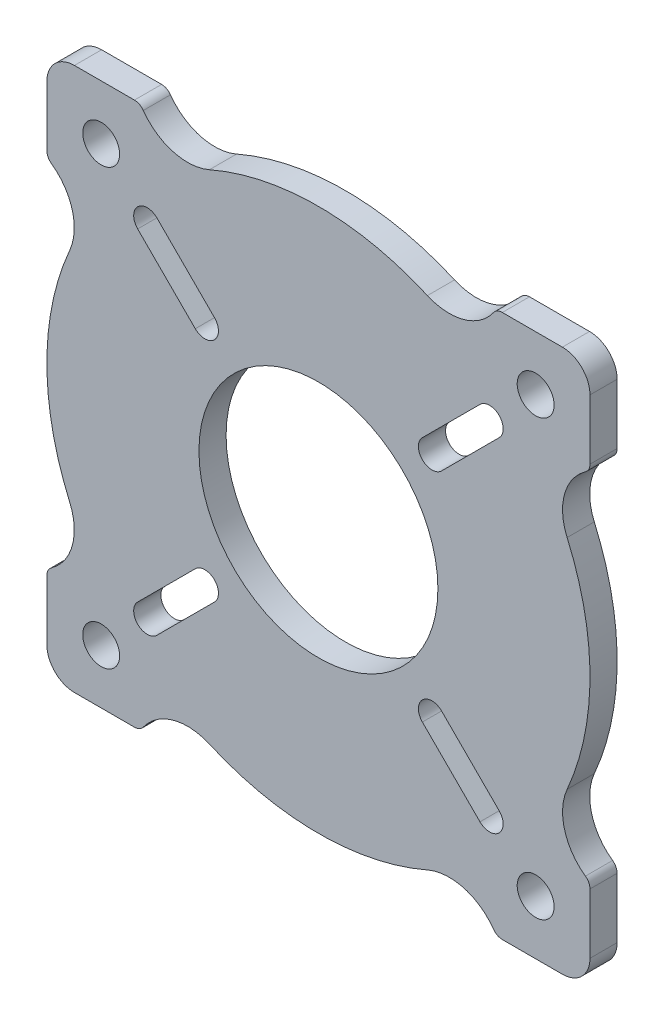
from build123d import *

# Parameters (mm, degrees)
ESQUISSE1_R        = 3.4
ESQUISSE1_R_2      = 22
BOSS_EXTRU_2_DEPTH = 5


with BuildPart() as part:
    # Esquisse1 → Boss.-Extru.2 (new body)
    with BuildSketch(Plane.XY):
        with BuildLine():
            ThreePointArc((44.919487431, -50), (48.51195232, -48.51195232), (50, -44.919487431))
            Line((50, -44.919487431), (50, -33.862050579))
            ThreePointArc((50, -33.862050579), (49.777389032, -32.945051), (49.159111773, -32.232185585))
            ThreePointArc((49.159111773, -32.232185585), (45.31641316, -26.748192273), (45.795558863, -20.069050512))
            ThreePointArc((45.795558863, -20.069050512), (48.937602838, -10.252366967), (50, 0))
            ThreePointArc((50, 0), (48.936869799, 10.255865358), (45.79268903, 20.075597908))
            ThreePointArc((45.79268903, 20.075597908), (45.313248124, 26.757056992), (49.158537806, 32.242082639))
            ThreePointArc((49.158537806, 32.242082639), (49.777227562, 32.955043184), (50, 33.872355669))
            Line((50, 33.872355669), (50, 44.919487431))
            ThreePointArc((50, 44.919487431), (48.51195232, 48.51195232), (44.919487431, 50))
            Line((44.919487431, 50), (33.862050579, 50))
            ThreePointArc((33.862050579, 50), (32.945051, 49.777389032), (32.232185585, 49.159111773))
            ThreePointArc((32.232185585, 49.159111773), (26.748192273, 45.31641316), (20.069050512, 45.795558863))
            ThreePointArc((20.069050512, 45.795558863), (10.252366967, 48.937602838), (0, 50))
            ThreePointArc((0, 50), (-10.255865358, 48.936869799), (-20.075597908, 45.79268903))
            ThreePointArc((-20.075597908, 45.79268903), (-26.757056992, 45.313248124), (-32.242082639, 49.158537806))
            ThreePointArc((-32.242082639, 49.158537806), (-32.955043184, 49.777227562), (-33.872355669, 50))
            Line((-33.872355669, 50), (-44.919487431, 50))
            ThreePointArc((-44.919487431, 50), (-48.51195232, 48.51195232), (-50, 44.919487431))
            Line((-50, 44.919487431), (-50, 33.862050579))
            ThreePointArc((-50, 33.862050579), (-49.777389032, 32.945051), (-49.159111773, 32.232185585))
            ThreePointArc((-49.159111773, 32.232185585), (-45.31641316, 26.748192273), (-45.795558863, 20.069050512))
            ThreePointArc((-45.795558863, 20.069050512), (-48.937602838, 10.252366967), (-50, 0))
            ThreePointArc((-50, 0), (-48.936869799, -10.255865358), (-45.79268903, -20.075597908))
            ThreePointArc((-45.79268903, -20.075597908), (-45.313248124, -26.757056992), (-49.158537806, -32.242082639))
            ThreePointArc((-49.158537806, -32.242082639), (-49.777227562, -32.955043184), (-50, -33.872355669))
            Line((-50, -33.872355669), (-50, -44.919487431))
            ThreePointArc((-50, -44.919487431), (-48.51195232, -48.51195232), (-44.919487431, -50))
            Line((-44.919487431, -50), (-33.862050579, -50))
            ThreePointArc((-33.862050579, -50), (-32.945051, -49.777389032), (-32.232185585, -49.159111773))
            ThreePointArc((-32.232185585, -49.159111773), (-26.748192273, -45.31641316), (-20.069050512, -45.795558863))
            ThreePointArc((-20.069050512, -45.795558863), (-10.252366967, -48.937602838), (0, -50))
            ThreePointArc((0, -50), (10.255865358, -48.936869799), (20.075597908, -45.79268903))
            ThreePointArc((20.075597908, -45.79268903), (26.757056992, -45.313248124), (32.242082639, -49.158537806))
            ThreePointArc((32.242082639, -49.158537806), (32.955043184, -49.777227562), (33.872355669, -50))
            Line((33.872355669, -50), (44.919487431, -50))
        make_face()
        with Locations((-40, -40)):
            Circle(ESQUISSE1_R, mode=Mode.SUBTRACT)
        with BuildLine():
            ThreePointArc((-29.746951128, -33.282485034), (-33.282485092, -33.282485209), (-33.28248515, -29.746951244))
            Line((-33.28248515, -29.746951244), (-22.675883316, -19.14034941))
            ThreePointArc((-22.675883316, -19.14034941), (-19.14034941, -19.14034941), (-19.14034941, -22.675883316))
            Line((-19.14034941, -22.675883316), (-29.746951128, -33.282485034))
        make_face(mode=Mode.SUBTRACT)
        with Locations((40, -40)):
            Circle(ESQUISSE1_R, mode=Mode.SUBTRACT)
        with BuildLine():
            ThreePointArc((33.282485034, -29.746951128), (33.282485209, -33.282485092), (29.746951244, -33.28248515))
            Line((29.746951244, -33.28248515), (19.14034941, -22.675883316))
            ThreePointArc((19.14034941, -22.675883316), (19.14034941, -19.14034941), (22.675883316, -19.14034941))
            Line((22.675883316, -19.14034941), (33.282485034, -29.746951128))
        make_face(mode=Mode.SUBTRACT)
        Circle(ESQUISSE1_R_2, mode=Mode.SUBTRACT)
        with BuildLine():
            ThreePointArc((-33.282485034, 29.746951128), (-33.282485209, 33.282485092), (-29.746951244, 33.28248515))
            Line((-29.746951244, 33.28248515), (-19.14034941, 22.675883316))
            ThreePointArc((-19.14034941, 22.675883316), (-19.14034941, 19.14034941), (-22.675883316, 19.14034941))
            Line((-22.675883316, 19.14034941), (-33.282485034, 29.746951128))
        make_face(mode=Mode.SUBTRACT)
        with Locations((-40, 40)):
            Circle(ESQUISSE1_R, mode=Mode.SUBTRACT)
        with BuildLine():
            ThreePointArc((29.746951128, 33.282485034), (33.282485092, 33.282485209), (33.28248515, 29.746951244))
            Line((33.28248515, 29.746951244), (22.675883316, 19.14034941))
            ThreePointArc((22.675883316, 19.14034941), (19.14034941, 19.14034941), (19.14034941, 22.675883316))
            Line((19.14034941, 22.675883316), (29.746951128, 33.282485034))
        make_face(mode=Mode.SUBTRACT)
        with Locations((40, 40)):
            Circle(ESQUISSE1_R, mode=Mode.SUBTRACT)
    extrude(amount=BOSS_EXTRU_2_DEPTH)


solid = part.part
